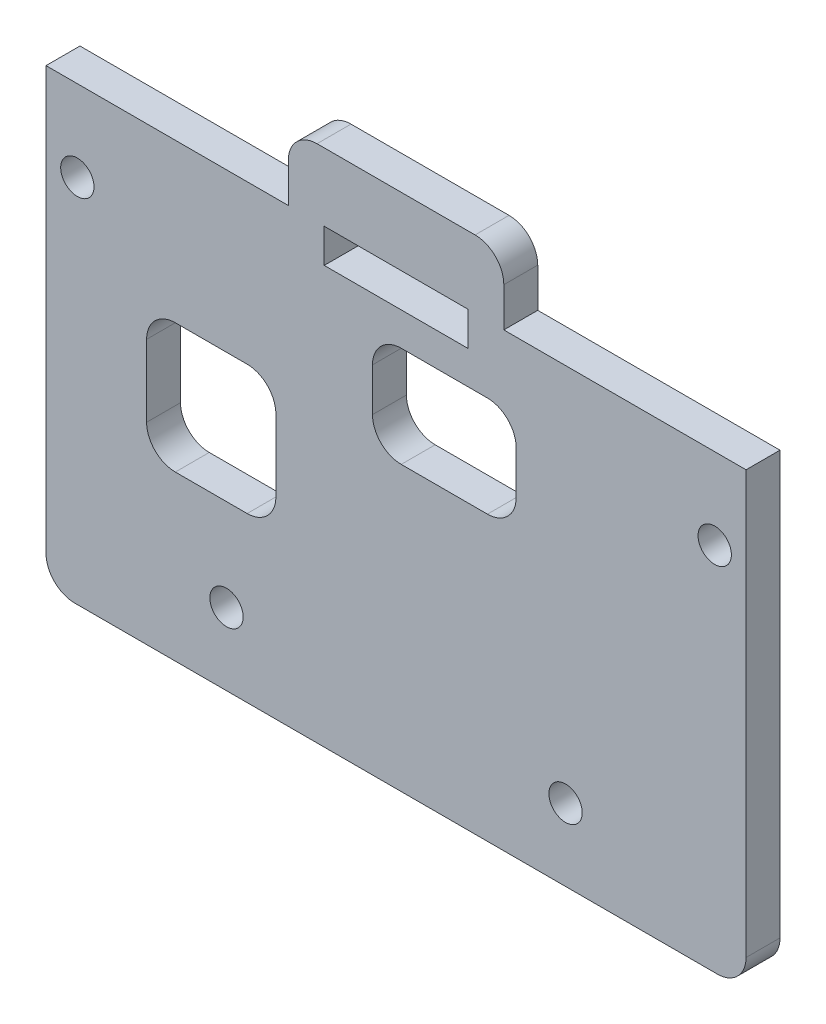
from build123d import *

# Parameters (mm, degrees)
SKETCH1_W                   = 61.88
SKETCH1_H                   = 45.878000096
BOSS_EXTRUDE1_DEPTH         = 3
F_32_0_116_DIAMETER_HOLE1_D = 2.9464
FILLET1_R                   = 2.54
SKETCH6_W                   = 12.7
SKETCH6_H                   = 3
CUT_EXTRUDE1_DEPTH          = 3
SKETCH7_W                   = 12.7
SKETCH7_H                   = 8.89
SKETCH7_W_2                 = 11.43
SKETCH7_H_2                 = 11.43
CUT_EXTRUDE2_DEPTH          = 78.090370947
FILLET2_R                   = 2.54
SKETCH9_W                   = 21.4122
SKETCH9_H                   = 6.000000096
SKETCH9_W_2                 = 21.4178
CUT_EXTRUDE3_DEPTH          = 78.090370947
FILLET4_R                   = 2.54


with BuildPart() as part:
    # Sketch1 → Boss-Extrude1 (new body)
    with BuildSketch(Plane.XY):
        with Locations((30.94, 22.939000048)):
            Rectangle(SKETCH1_W, SKETCH1_H)
    extrude(amount=BOSS_EXTRUDE1_DEPTH)

    # #32 (0.116) Diameter Hole1 (through all)
    with Locations(Plane.XY.offset(3)):
        with Locations((15.954, 6.373999952), (45.926, 6.373999952), (59.11, 32.7152), (2.77, 32.7152)):
            Hole(F_32_0_116_DIAMETER_HOLE1_D / 2)

    # Fillet1
    fillet1_edges = [part.edges().sort_by_distance(p)[0] for p in [
        (61.88, 0, 1.5),
        (0, 0, 1.5),
    ]]
    fillet(fillet1_edges, radius=FILLET1_R)

    # Sketch6 → Cut-Extrude1 (cut)
    with BuildSketch(Plane(origin=(0, 0, 0), x_dir=(-1, 0, 0), z_dir=(0, 0, -1))):
        with Locations((-30.9428, 38.378)):
            Rectangle(SKETCH6_W, SKETCH6_H)
    extrude(amount=-CUT_EXTRUDE1_DEPTH, mode=Mode.SUBTRACT)

    # Sketch7 → Cut-Extrude2 (cut, through all)
    with BuildSketch(Plane(origin=(0, 0, 0), x_dir=(-1, 0, 0), z_dir=(0, 0, -1))):
        with Locations((-35.21, 29.495000096)):
            Rectangle(SKETCH7_W, SKETCH7_H)
        with Locations((-14.605, 20.193)):
            Rectangle(SKETCH7_W_2, SKETCH7_H_2)
    extrude(amount=-CUT_EXTRUDE2_DEPTH, mode=Mode.SUBTRACT)

    # Fillet2
    fillet2_edges = [part.edges().sort_by_distance(p)[0] for p in [
        (41.56, 25.050000096, 1.5),
        (41.56, 33.940000096, 1.5),
        (28.86, 33.940000096, 1.5),
        (28.86, 25.050000096, 1.5),
        (20.32, 14.478, 1.5),
        (20.32, 25.908, 1.5),
        (8.89, 25.908, 1.5),
        (8.89, 14.478, 1.5),
    ]]
    fillet(fillet2_edges, radius=FILLET2_R)

    # Sketch9 → Cut-Extrude3 (cut, through all)
    with BuildSketch(Plane(origin=(0, 0, 0), x_dir=(-1, 0, 0), z_dir=(0, 0, -1))):
        with Locations((-51.1739, 42.878000048)):
            Rectangle(SKETCH9_W, SKETCH9_H)
        with Locations((-10.7089, 42.878000048)):
            Rectangle(SKETCH9_W_2, SKETCH9_H)
    extrude(amount=-CUT_EXTRUDE3_DEPTH, mode=Mode.SUBTRACT)

    # Fillet4
    fillet4_edges = [part.edges().sort_by_distance(p)[0] for p in [
        (40.4678, 45.878000096, 1.5),
        (21.4178, 45.878000096, 1.5),
    ]]
    fillet(fillet4_edges, radius=FILLET4_R)


solid = part.part
